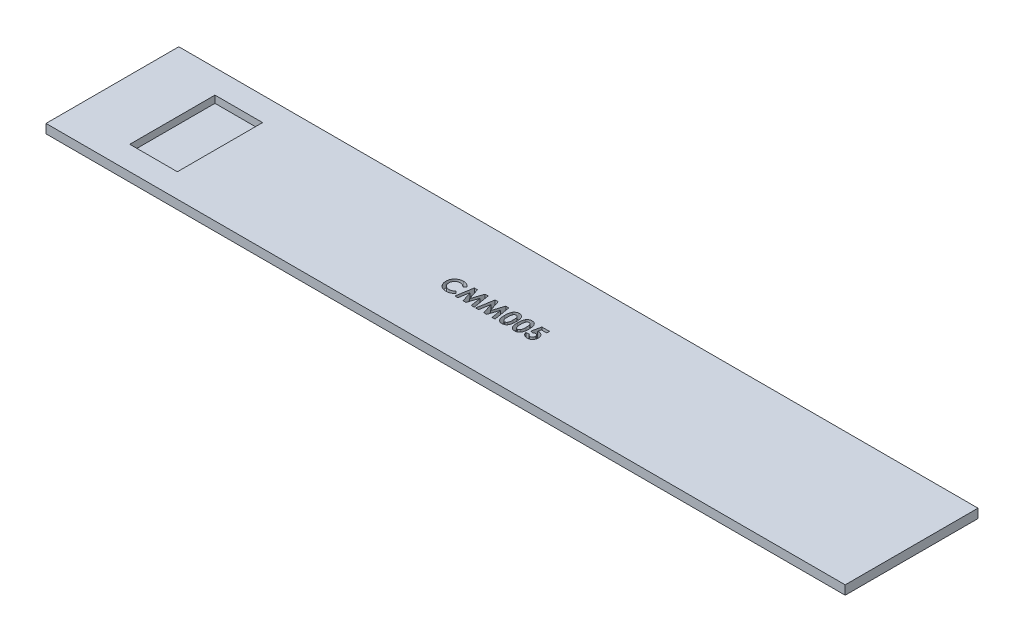
from build123d import *

# Parameters (mm, degrees)
SKETCH1_W           = 167.9
SKETCH1_H           = 27.9
BOSS_EXTRUDE1_DEPTH = 1.9
SKETCH2_W           = 10
SKETCH2_H           = 17.9
CUT_EXTRUDE1_DEPTH  = 1.5
CUT_EXTRUDE2_DEPTH  = 1.25


with BuildPart() as part:
    # Sketch1 → Boss-Extrude1 (new body)
    with BuildSketch(Plane(origin=(0, 0, 0), x_dir=(1, 0, 0), z_dir=(0, 1, 0))):
        with Locations((83.95, 13.95)):
            Rectangle(SKETCH1_W, SKETCH1_H)
    extrude(amount=BOSS_EXTRUDE1_DEPTH)

    # Sketch2 → Cut-Extrude1 (cut)
    with BuildSketch(Plane(origin=(0, 1.9, 0), x_dir=(1, 0, 0), z_dir=(0, 1, 0))):
        with Locations((17.597863854, 13.95)):
            Rectangle(SKETCH2_W, SKETCH2_H)
    extrude(amount=-CUT_EXTRUDE1_DEPTH, mode=Mode.SUBTRACT)

    # Sketch4 → Cut-Extrude2 (cut)
    # profile 1 of 6: a face of its own
    with BuildSketch(Plane(origin=(0, 1.9, 0), x_dir=(1, 0, 0), z_dir=(0, 1, 0))):
        with BuildLine():
            Line((74.029946467, 14.44485709), (73.569309447, 14.004552603))
            add(Edge.make_bspline(
                [(73.569309447, 14.004552603), (73.530234463, 14.044956202), (73.453908776, 14.123877091), (73.330919371, 14.228361392), (73.203014868, 14.315434919), (73.072683393, 14.38876769), (72.937580662, 14.444249157), (72.79926883, 14.484679437), (72.656864735, 14.50932825), (72.56049112, 14.512148511), (72.512017781, 14.513567026)],
                knots=[0, 0, 0, 0, 1.115251505, 2.178435587, 3.19620269, 4.182487026, 5.141301733, 6.088180966, 7.038406374, 8, 8, 8, 8], degree=3))
            add(Edge.make_bspline(
                [(72.512017781, 14.513567026), (72.471536651, 14.512446349), (72.391651603, 14.510234817), (72.274359418, 14.494022107), (72.162163381, 14.466451688), (72.054679428, 14.428454543), (71.952223835, 14.379288255), (71.85458179, 14.318990876), (71.761994026, 14.248106977), (71.675683574, 14.167003316), (71.596729806, 14.078391472), (71.526969124, 13.983842845), (71.468533363, 13.883574042), (71.420576085, 13.778600511), (71.383219219, 13.668436383), (71.356541723, 13.553155824), (71.341112172, 13.432621544), (71.338809208, 13.350683239), (71.337638774, 13.309039782)],
                knots=[0, 0, 0, 0, 1.035432265, 2.043311493, 3.022114605, 3.98653278, 4.95457646, 5.923598177, 6.917315552, 7.932509744, 8.948865224, 9.949768934, 10.933144597, 11.912367597, 12.897413939, 13.903909035, 14.934704909, 16, 16, 16, 16], degree=3))
            add(Edge.make_bspline(
                [(71.337638774, 13.309039782), (71.33797608, 13.27981149), (71.338640917, 13.222201927), (71.345918728, 13.136981393), (71.35763772, 13.054297328), (71.374598005, 12.974274976), (71.395807009, 12.89684499), (71.420689999, 12.821339384), (71.451905345, 12.748801476), (71.486554849, 12.678388786), (71.526851824, 12.612022611), (71.570299396, 12.548736956), (71.617411194, 12.488842039), (71.668492365, 12.432582715), (71.724261812, 12.380838189), (71.783278101, 12.332052442), (71.846536755, 12.287446746), (71.912723733, 12.245901674), (71.982410805, 12.209811116), (72.0537072, 12.177120043), (72.127693914, 12.150570031), (72.203470116, 12.1291683), (72.280765008, 12.110969323), (72.360334605, 12.099763654), (72.441489139, 12.091277732), (72.496335982, 12.090753776), (72.523936851, 12.090490103)],
                knots=[0, 0, 0, 0, 1.103660481, 2.175337485, 3.227646561, 4.255952547, 5.262355991, 6.258840057, 7.255597736, 8.242457506, 9.22035537, 10.185017736, 11.140346927, 12.096287581, 13.051739095, 14.01125915, 14.986044842, 15.97314143, 16.960198552, 17.947847494, 18.933482797, 19.925264591, 20.920966487, 21.929612487, 22.958107872, 24, 24, 24, 24], degree=3))
            add(Edge.make_bspline(
                [(72.523936851, 12.090490103), (72.570752668, 12.091844265), (72.662733574, 12.094504841), (72.79772878, 12.115310168), (72.926365762, 12.149533753), (73.029146096, 12.189949819), (73.109671772, 12.229861209), (73.170974779, 12.266777279), (73.234366866, 12.308071957), (73.298795145, 12.355303748), (73.364984306, 12.407905852), (73.431765958, 12.467030353), (73.500849723, 12.530730366), (73.546105812, 12.576194317), (73.569309447, 12.599504526)],
                knots=[0, 0, 0, 0, 1.404581149, 2.759636711, 4.088442092, 5.392261763, 6.066678138, 6.783632037, 7.538459478, 8.336747902, 9.180226004, 10.074962426, 11.012997595, 12, 12, 12, 12], degree=3))
            Line((73.569309447, 12.599504526), (74.015924031, 12.130454045))
            add(Edge.make_bspline(
                [(74.015924031, 12.130454045), (73.984529429, 12.100143543), (73.923253882, 12.040983926), (73.830821419, 11.956982789), (73.738505286, 11.88149843), (73.648535649, 11.811791096), (73.55943871, 11.749891533), (73.471223919, 11.695737919), (73.384889906, 11.647960633), (73.298643916, 11.607365413), (73.211949283, 11.572895856), (73.122750694, 11.543219829), (73.03077546, 11.518114978), (72.935461839, 11.497858661), (72.837698857, 11.481615829), (72.736571583, 11.470652011), (72.632721215, 11.463281401), (72.562277901, 11.462619091), (72.526741338, 11.462284975)],
                knots=[0, 0, 0, 0, 1.244526981, 2.429050516, 3.560637417, 4.644440555, 5.67424972, 6.652764056, 7.595344123, 8.486817594, 9.369275933, 10.254498637, 11.166417451, 12.086725134, 13.032340136, 13.991389299, 14.986715468, 16, 16, 16, 16], degree=3))
            add(Edge.make_bspline(
                [(72.526741338, 11.462284975), (72.461465074, 11.463948997), (72.333737571, 11.467205026), (72.146556244, 11.491329994), (71.968739008, 11.53177508), (71.799853267, 11.588975586), (71.639952723, 11.662046552), (71.489078283, 11.751628125), (71.347473123, 11.857482302), (71.216281133, 11.978368367), (71.097611736, 12.111876878), (70.992721731, 12.255228393), (70.905956714, 12.40912743), (70.833913852, 12.571300411), (70.777577281, 12.742487392), (70.737925886, 12.922873547), (70.71347316, 13.112284701), (70.710797997, 13.241656885), (70.709433646, 13.307637539)],
                knots=[0, 0, 0, 0, 1.078019885, 2.10938526, 3.111377082, 4.085535484, 5.04941344, 6.010039228, 6.978205633, 7.964457913, 8.951525778, 9.924444315, 10.892603023, 11.863865945, 12.85144698, 13.863884204, 14.910567087, 16, 16, 16, 16], degree=3))
            add(Edge.make_bspline(
                [(70.709433646, 13.307637539), (70.710010154, 13.350669558), (70.711152653, 13.435948503), (70.723160421, 13.561571297), (70.739899946, 13.684031051), (70.766455682, 13.802056227), (70.798466003, 13.917236841), (70.838275042, 14.028321015), (70.885819219, 14.135628016), (70.939566073, 14.239337481), (71.000369352, 14.338770004), (71.068293289, 14.433071302), (71.141589258, 14.522969363), (71.222018441, 14.607271523), (71.308412097, 14.686717971), (71.401160283, 14.760878172), (71.499705166, 14.830815667), (71.604313469, 14.894726937), (71.712952932, 14.952538078), (71.824253326, 15.003529974), (71.937941198, 15.046147456), (72.053535866, 15.081497085), (72.171525716, 15.107883084), (72.291068566, 15.127856433), (72.413181582, 15.139021664), (72.495169894, 15.140849483), (72.536557044, 15.141772154)],
                knots=[0, 0, 0, 0, 1.071919942, 2.124283339, 3.142214191, 4.149696895, 5.136002878, 6.119640489, 7.086990633, 8.058538607, 9.028339693, 9.988281803, 10.952401235, 11.916291999, 12.888973767, 13.874849856, 14.873389453, 15.898127285, 16.927174885, 17.938320013, 18.946391617, 19.950418109, 20.947802303, 21.956882652, 22.968648068, 24, 24, 24, 24], degree=3))
            add(Edge.make_bspline(
                [(72.536557044, 15.141772154), (72.571864526, 15.141243256), (72.642112391, 15.140190959), (72.74672325, 15.131418919), (72.85049748, 15.117642518), (72.953063538, 15.096856863), (73.055155081, 15.072181663), (73.155430512, 15.039872894), (73.25547173, 15.003858681), (73.353709736, 14.960811044), (73.450281658, 14.913820659), (73.542925145, 14.860508361), (73.633195673, 14.804154929), (73.719092901, 14.74142512), (73.80222587, 14.674594261), (73.88215987, 14.603350549), (73.958193432, 14.526506141), (74.005907875, 14.47221103), (74.029946467, 14.44485709)],
                knots=[0, 0, 0, 0, 0.996412454, 1.982464992, 2.961075852, 3.949442424, 4.934965278, 5.923860011, 6.921385422, 7.934793307, 8.949617135, 9.951082467, 10.950285876, 11.951772932, 12.951063433, 13.960125323, 14.972308753, 16, 16, 16, 16], degree=3))
        make_face()
    # profile 2 of 6: a face of its own
    with BuildSketch(Plane(origin=(0, 1.9, 0), x_dir=(1, 0, 0), z_dir=(0, 1, 0))):
        Polygon((74.935094704, 15.052028564), (75.587137973, 15.052028564), (76.385715697, 12.610722475), (77.189902396, 15.052028564), (77.835635569, 15.052028564), (78.427382364, 11.552028564), (77.791464896, 11.552028564), (77.417766979, 13.762665584), (76.690002556, 11.552028564), (76.077222108, 11.552028564), (75.353664415, 13.762665584), (74.98066762, 11.552028564), (74.344049031, 11.552028564), align=None)
    # profile 3 of 6: a face of its own
    with BuildSketch(Plane(origin=(0, 1.9, 0), x_dir=(1, 0, 0), z_dir=(0, 1, 0))):
        Polygon((79.287658806, 15.052028564), (79.939702076, 15.052028564), (80.7382798, 12.610722475), (81.542466499, 15.052028564), (82.188199672, 15.052028564), (82.779946467, 11.552028564), (82.144028999, 11.552028564), (81.770331082, 13.762665584), (81.042566659, 11.552028564), (80.42978621, 11.552028564), (79.706228518, 13.762665584), (79.333231723, 11.552028564), (78.696613133, 11.552028564), align=None)
    # profile 4 of 6: a face of its own
    with BuildSketch(Plane(origin=(0, 1.9, 0), x_dir=(1, 0, 0), z_dir=(0, 1, 0))):
        with BuildLine():
            add(Edge.make_bspline(
                [(84.272634768, 15.141772154), (84.303042503, 15.141320743), (84.362832236, 15.140433147), (84.450891257, 15.130819766), (84.535716442, 15.116296627), (84.617639636, 15.096041914), (84.696071148, 15.069235522), (84.771581819, 15.03714873), (84.843272854, 14.99809852), (84.912058542, 14.953989302), (84.977912387, 14.904051415), (85.039251637, 14.847119645), (85.097196478, 14.784503994), (85.150492618, 14.715257827), (85.200320316, 14.640011011), (85.246515845, 14.558751614), (85.288725569, 14.471081925), (85.327422557, 14.376843738), (85.362025526, 14.274624463), (85.391171564, 14.163251601), (85.416169168, 14.042699717), (85.43726891, 13.91266874), (85.453216905, 13.772985828), (85.463966174, 13.623743778), (85.471342832, 13.465230309), (85.471944863, 13.356491371), (85.472254159, 13.300626321)],
                knots=[0, 0, 0, 0, 0.879237366, 1.728815576, 2.559023295, 3.367336655, 4.166867292, 4.954216142, 5.737608147, 6.525189134, 7.316157332, 8.124696809, 8.942788509, 9.781158001, 10.649253743, 11.551476218, 12.482711956, 13.461909668, 14.496590415, 15.601789533, 16.789733467, 18.056700938, 19.410929216, 20.8549011, 22.384193279, 24, 24, 24, 24], degree=3))
            add(Edge.make_bspline(
                [(85.472254159, 13.300626321), (85.471919894, 13.244062336), (85.471270422, 13.134159529), (85.464272824, 12.974196215), (85.452222629, 12.823870578), (85.436691469, 12.683198172), (85.415418028, 12.552253284), (85.390503871, 12.430696853), (85.360897772, 12.318572942), (85.325154992, 12.216134189), (85.286692238, 12.121730499), (85.244367052, 12.034231746), (85.198917158, 11.953400933), (85.151385038, 11.878018619), (85.099164806, 11.810307036), (85.044798169, 11.747963635), (84.985917907, 11.693363158), (84.925003105, 11.643691739), (84.859822209, 11.600765666), (84.791047411, 11.56322323), (84.717452577, 11.532771855), (84.640379215, 11.506286876), (84.558513594, 11.487273519), (84.473156548, 11.472187045), (84.383344412, 11.463849334), (84.322196693, 11.462814986), (84.290863935, 11.462284975)],
                knots=[0, 0, 0, 0, 1.643780988, 3.193836972, 4.651895693, 6.025988579, 7.305620092, 8.505800249, 9.631074763, 10.672816429, 11.65661981, 12.592235626, 13.49536222, 14.350718032, 15.179365177, 15.97804903, 16.751647189, 17.51006938, 18.259804725, 19.016521909, 19.783502495, 20.571750527, 21.382245291, 22.22305063, 23.089471752, 24, 24, 24, 24], degree=3))
            add(Edge.make_bspline(
                [(84.290863935, 11.462284975), (84.259532022, 11.462825209), (84.198153265, 11.463883521), (84.108098268, 11.47212505), (84.022288873, 11.487334634), (83.939775563, 11.506432847), (83.86113262, 11.532713255), (83.785982951, 11.564075713), (83.714904395, 11.601383903), (83.647700144, 11.64440999), (83.584599653, 11.693749069), (83.524622341, 11.748873402), (83.467900882, 11.809643265), (83.41529815, 11.876739329), (83.365952663, 11.949266003), (83.320379018, 12.028051505), (83.278604602, 12.112981126), (83.239322705, 12.204173248), (83.205191709, 12.303591135), (83.174816707, 12.412122573), (83.149934305, 12.530672264), (83.129922212, 12.659202122), (83.113944568, 12.797439849), (83.102059038, 12.945452171), (83.095022571, 13.103308026), (83.09437991, 13.211810219), (83.094049031, 13.267673596)],
                knots=[0, 0, 0, 0, 0.917216111, 1.796812873, 2.643793957, 3.46689424, 4.273913431, 5.068098542, 5.848489301, 6.620921603, 7.401012384, 8.190319798, 9.003608147, 9.831726257, 10.68377682, 11.569763213, 12.493818149, 13.453288342, 14.474581811, 15.568529029, 16.750744269, 18.018426408, 19.375425659, 20.823733699, 22.36466933, 24, 24, 24, 24], degree=3))
            add(Edge.make_bspline(
                [(83.094049031, 13.267673596), (83.094648389, 13.345291362), (83.095804857, 13.49505584), (83.110460478, 13.711421966), (83.131971211, 13.91141497), (83.163565383, 14.094700313), (83.20263114, 14.261956829), (83.252656876, 14.412082721), (83.309607537, 14.547155316), (83.358136817, 14.627173135), (83.381508967, 14.665710455)],
                knots=[0, 0, 0, 0, 1.288568992, 2.486310467, 3.599230591, 4.627010532, 5.572937695, 6.447898582, 7.252493626, 8, 8, 8, 8], degree=3))
            add(Edge.make_bspline(
                [(83.381508967, 14.665710455), (83.408684989, 14.703569507), (83.461819466, 14.777591412), (83.554726586, 14.874768338), (83.65454319, 14.957878804), (83.763319454, 15.025041944), (83.879335037, 15.078006803), (84.00358599, 15.115415286), (84.135613477, 15.137211211), (84.226278954, 15.140229137), (84.272634768, 15.141772154)],
                knots=[0, 0, 0, 0, 1.058512271, 2.069600068, 3.047294572, 4.004278952, 4.967380941, 5.939006123, 6.946246673, 8, 8, 8, 8], degree=3))
        make_face()
        with BuildLine():
            add(Edge.make_bspline(
                [(84.288059447, 14.513567026), (84.260570602, 14.512264109), (84.206677874, 14.509709701), (84.128476957, 14.48802638), (84.054738375, 14.45453532), (83.998647406, 14.414234067), (83.956663873, 14.375600483), (83.927329677, 14.340638345), (83.899041469, 14.301623119), (83.874055899, 14.256794249), (83.850462999, 14.207762488), (83.827405624, 14.154305262), (83.808504631, 14.095109546), (83.789934906, 14.031183449), (83.773666095, 13.960759587), (83.760036398, 13.88326232), (83.747859461, 13.798187678), (83.739365903, 13.705479936), (83.731447357, 13.60523609), (83.725770969, 13.497232835), (83.723397814, 13.381499308), (83.72264346, 13.301795345), (83.722254159, 13.260662378)],
                knots=[0, 0, 0, 0, 1.076674018, 2.110852608, 3.161083442, 4.239746716, 4.804137807, 5.395870207, 6.026861976, 6.692161227, 7.405688833, 8.16177676, 8.973626916, 9.841385931, 10.773283133, 11.807421078, 12.927755683, 14.143907515, 15.458935494, 16.872852025, 18.386167141, 20, 20, 20, 20], degree=3))
            add(Edge.make_bspline(
                [(83.722254159, 13.260662378), (83.722894901, 13.207372631), (83.724123571, 13.105185591), (83.73055877, 12.958237068), (83.743457592, 12.824502079), (83.759501123, 12.703074254), (83.782034918, 12.594741083), (83.807961507, 12.498477635), (83.839978539, 12.415511034), (83.876980389, 12.344641398), (83.917961605, 12.284352746), (83.962448518, 12.23310712), (84.008926508, 12.188730825), (84.058846303, 12.152684508), (84.112088811, 12.125060272), (84.168209554, 12.105190501), (84.227244196, 12.093027386), (84.26767051, 12.091340753), (84.288059447, 12.090490103)],
                knots=[0, 0, 0, 0, 1.771748488, 3.397459088, 4.888034009, 6.237357457, 7.467047327, 8.564189669, 9.548206622, 10.417051504, 11.216568818, 11.965764335, 12.669334354, 13.348544111, 14.005342236, 14.656555988, 15.322436492, 16, 16, 16, 16], degree=3))
            add(Edge.make_bspline(
                [(84.288059447, 12.090490103), (84.307748701, 12.091072181), (84.346297811, 12.092211817), (84.402511046, 12.103910033), (84.455670276, 12.122928791), (84.505614996, 12.14983216), (84.552523851, 12.184043909), (84.59616758, 12.22571438), (84.63621703, 12.27525893), (84.659550022, 12.312028314), (84.671573069, 12.330974878)],
                knots=[0, 0, 0, 0, 0.992283464, 1.942767638, 2.88273346, 3.832339453, 4.79467288, 5.803907806, 6.868395428, 8, 8, 8, 8], degree=3))
            add(Edge.make_bspline(
                [(84.671573069, 12.330974878), (84.685728182, 12.356864753), (84.715410307, 12.411153722), (84.749758512, 12.502764332), (84.778670917, 12.606085959), (84.803555401, 12.721440149), (84.82057487, 12.849281874), (84.835232016, 12.988800479), (84.842301522, 13.140698522), (84.843451416, 13.245934035), (84.844049031, 13.300626321)],
                knots=[0, 0, 0, 0, 0.710965849, 1.490837728, 2.352621235, 3.297892224, 4.334225155, 5.461620853, 6.680770821, 8, 8, 8, 8], degree=3))
            add(Edge.make_bspline(
                [(84.844049031, 13.300626321), (84.843818185, 13.355793362), (84.843373846, 13.4619805), (84.835221519, 13.614424627), (84.823868781, 13.753657037), (84.807263003, 13.87936688), (84.78589665, 13.991859325), (84.75956254, 14.091127018), (84.728516583, 14.177365597), (84.691699779, 14.250489069), (84.65092288, 14.31263399), (84.607636957, 14.365949511), (84.561658979, 14.411468958), (84.513065837, 14.449363629), (84.460732826, 14.478317999), (84.405659573, 14.49876218), (84.347733175, 14.511130224), (84.308219171, 14.512743795), (84.288059447, 14.513567026)],
                knots=[0, 0, 0, 0, 1.793836731, 3.452829483, 4.963243077, 6.335886805, 7.574563692, 8.684454726, 9.672768357, 10.54971625, 11.340229787, 12.085688095, 12.778991901, 13.440269426, 14.083255152, 14.715733572, 15.344777694, 16, 16, 16, 16], degree=3))
        make_face(mode=Mode.SUBTRACT)
    # profile 5 of 6: a face of its own
    with BuildSketch(Plane(origin=(0, 1.9, 0), x_dir=(1, 0, 0), z_dir=(0, 1, 0))):
        with BuildLine():
            add(Edge.make_bspline(
                [(86.96494246, 15.141772154), (86.995350196, 15.141320743), (87.055139928, 15.140433147), (87.14319895, 15.130819766), (87.228024134, 15.116296627), (87.309947328, 15.096041914), (87.38837884, 15.069235522), (87.463889512, 15.03714873), (87.535580546, 14.99809852), (87.604366234, 14.953989302), (87.670220079, 14.904051415), (87.731559329, 14.847119645), (87.789504171, 14.784503994), (87.842800311, 14.715257827), (87.892628008, 14.640011011), (87.938823538, 14.558751614), (87.981033261, 14.471081925), (88.019730249, 14.376843738), (88.054333218, 14.274624463), (88.083479256, 14.163251601), (88.10847686, 14.042699717), (88.129576602, 13.91266874), (88.145524597, 13.772985828), (88.156273866, 13.623743778), (88.163650524, 13.465230309), (88.164252555, 13.356491371), (88.164561851, 13.300626321)],
                knots=[0, 0, 0, 0, 0.879237366, 1.728815576, 2.559023295, 3.367336655, 4.166867292, 4.954216142, 5.737608147, 6.525189134, 7.316157332, 8.124696809, 8.942788509, 9.781158001, 10.649253743, 11.551476218, 12.482711956, 13.461909668, 14.496590415, 15.601789533, 16.789733467, 18.056700938, 19.410929216, 20.8549011, 22.384193279, 24, 24, 24, 24], degree=3))
            add(Edge.make_bspline(
                [(88.164561851, 13.300626321), (88.164227586, 13.244062336), (88.163578114, 13.134159529), (88.156580516, 12.974196215), (88.144530322, 12.823870578), (88.128999161, 12.683198172), (88.10772572, 12.552253284), (88.082811563, 12.430696853), (88.053205464, 12.318572942), (88.017462684, 12.216134189), (87.97899993, 12.121730499), (87.936674745, 12.034231746), (87.89122485, 11.953400933), (87.84369273, 11.878018619), (87.791472499, 11.810307036), (87.737105862, 11.747963635), (87.678225599, 11.693363158), (87.617310798, 11.643691739), (87.552129901, 11.600765666), (87.483355104, 11.56322323), (87.409760269, 11.532771855), (87.332686907, 11.506286876), (87.250821287, 11.487273519), (87.16546424, 11.472187045), (87.075652105, 11.463849334), (87.014504385, 11.462814986), (86.983171627, 11.462284975)],
                knots=[0, 0, 0, 0, 1.643780988, 3.193836972, 4.651895693, 6.025988579, 7.305620092, 8.505800249, 9.631074763, 10.672816429, 11.65661981, 12.592235626, 13.49536222, 14.350718032, 15.179365177, 15.97804903, 16.751647189, 17.51006938, 18.259804725, 19.016521909, 19.783502495, 20.571750527, 21.382245291, 22.22305063, 23.089471752, 24, 24, 24, 24], degree=3))
            add(Edge.make_bspline(
                [(86.983171627, 11.462284975), (86.951839714, 11.462825209), (86.890460957, 11.463883521), (86.800405961, 11.47212505), (86.714596565, 11.487334634), (86.632083256, 11.506432847), (86.553440312, 11.532713255), (86.478290644, 11.564075713), (86.407212087, 11.601383903), (86.340007836, 11.64440999), (86.276907345, 11.693749069), (86.216930034, 11.748873402), (86.160208575, 11.809643265), (86.107605842, 11.876739329), (86.058260355, 11.949266003), (86.01268671, 12.028051505), (85.970912295, 12.112981126), (85.931630398, 12.204173248), (85.897499401, 12.303591135), (85.8671244, 12.412122573), (85.842241997, 12.530672264), (85.822229904, 12.659202122), (85.80625226, 12.797439849), (85.79436673, 12.945452171), (85.787330263, 13.103308026), (85.786687603, 13.211810219), (85.786356723, 13.267673596)],
                knots=[0, 0, 0, 0, 0.917216111, 1.796812873, 2.643793957, 3.46689424, 4.273913431, 5.068098542, 5.848489301, 6.620921603, 7.401012384, 8.190319798, 9.003608147, 9.831726257, 10.68377682, 11.569763213, 12.493818149, 13.453288342, 14.474581811, 15.568529029, 16.750744269, 18.018426408, 19.375425659, 20.823733699, 22.36466933, 24, 24, 24, 24], degree=3))
            add(Edge.make_bspline(
                [(85.786356723, 13.267673596), (85.786956081, 13.345291362), (85.788112549, 13.49505584), (85.80276817, 13.711421966), (85.824278903, 13.91141497), (85.855873076, 14.094700313), (85.894938833, 14.261956829), (85.944964568, 14.412082721), (86.00191523, 14.547155316), (86.05044451, 14.627173135), (86.073816659, 14.665710455)],
                knots=[0, 0, 0, 0, 1.288568992, 2.486310467, 3.599230591, 4.627010532, 5.572937695, 6.447898582, 7.252493626, 8, 8, 8, 8], degree=3))
            add(Edge.make_bspline(
                [(86.073816659, 14.665710455), (86.100992681, 14.703569507), (86.154127159, 14.777591412), (86.247034278, 14.874768338), (86.346850882, 14.957878804), (86.455627147, 15.025041944), (86.571642729, 15.078006803), (86.695893682, 15.115415286), (86.827921169, 15.137211211), (86.918586646, 15.140229137), (86.96494246, 15.141772154)],
                knots=[0, 0, 0, 0, 1.058512271, 2.069600068, 3.047294572, 4.004278952, 4.967380941, 5.939006123, 6.946246673, 8, 8, 8, 8], degree=3))
        make_face()
        with BuildLine():
            add(Edge.make_bspline(
                [(86.98036714, 14.513567026), (86.952878295, 14.512264109), (86.898985566, 14.509709701), (86.82078465, 14.48802638), (86.747046068, 14.45453532), (86.690955098, 14.414234067), (86.648971565, 14.375600483), (86.61963737, 14.340638345), (86.591349161, 14.301623119), (86.566363591, 14.256794249), (86.542770691, 14.207762488), (86.519713316, 14.154305262), (86.500812323, 14.095109546), (86.482242599, 14.031183449), (86.465973787, 13.960759587), (86.45234409, 13.88326232), (86.440167153, 13.798187678), (86.431673595, 13.705479936), (86.42375505, 13.60523609), (86.418078661, 13.497232835), (86.415705506, 13.381499308), (86.414951152, 13.301795345), (86.414561851, 13.260662378)],
                knots=[0, 0, 0, 0, 1.076674018, 2.110852608, 3.161083442, 4.239746716, 4.804137807, 5.395870207, 6.026861976, 6.692161227, 7.405688833, 8.16177676, 8.973626916, 9.841385931, 10.773283133, 11.807421078, 12.927755683, 14.143907515, 15.458935494, 16.872852025, 18.386167141, 20, 20, 20, 20], degree=3))
            add(Edge.make_bspline(
                [(86.414561851, 13.260662378), (86.415202593, 13.207372631), (86.416431263, 13.105185591), (86.422866462, 12.958237068), (86.435765285, 12.824502079), (86.451808816, 12.703074254), (86.47434261, 12.594741083), (86.500269199, 12.498477635), (86.532286232, 12.415511034), (86.569288082, 12.344641398), (86.610269298, 12.284352746), (86.65475621, 12.23310712), (86.7012342, 12.188730825), (86.751153995, 12.152684508), (86.804396503, 12.125060272), (86.860517246, 12.105190501), (86.919551888, 12.093027386), (86.959978203, 12.091340753), (86.98036714, 12.090490103)],
                knots=[0, 0, 0, 0, 1.771748488, 3.397459088, 4.888034009, 6.237357457, 7.467047327, 8.564189669, 9.548206622, 10.417051504, 11.216568818, 11.965764335, 12.669334354, 13.348544111, 14.005342236, 14.656555988, 15.322436492, 16, 16, 16, 16], degree=3))
            add(Edge.make_bspline(
                [(86.98036714, 12.090490103), (87.000056393, 12.091072181), (87.038605503, 12.092211817), (87.094818738, 12.103910033), (87.147977968, 12.122928791), (87.197922688, 12.14983216), (87.244831543, 12.184043909), (87.288475272, 12.22571438), (87.328524723, 12.27525893), (87.351857714, 12.312028314), (87.363880761, 12.330974878)],
                knots=[0, 0, 0, 0, 0.992283464, 1.942767638, 2.88273346, 3.832339453, 4.79467288, 5.803907806, 6.868395428, 8, 8, 8, 8], degree=3))
            add(Edge.make_bspline(
                [(87.363880761, 12.330974878), (87.378035875, 12.356864753), (87.407717999, 12.411153722), (87.442066204, 12.502764332), (87.470978609, 12.606085959), (87.495863093, 12.721440149), (87.512882563, 12.849281874), (87.527539709, 12.988800479), (87.534609214, 13.140698522), (87.535759108, 13.245934035), (87.536356723, 13.300626321)],
                knots=[0, 0, 0, 0, 0.710965849, 1.490837728, 2.352621235, 3.297892224, 4.334225155, 5.461620853, 6.680770821, 8, 8, 8, 8], degree=3))
            add(Edge.make_bspline(
                [(87.536356723, 13.300626321), (87.536125877, 13.355793362), (87.535681539, 13.4619805), (87.527529212, 13.614424627), (87.516176474, 13.753657037), (87.499570695, 13.87936688), (87.478204343, 13.991859325), (87.451870233, 14.091127018), (87.420824276, 14.177365597), (87.384007471, 14.250489069), (87.343230572, 14.31263399), (87.299944649, 14.365949511), (87.253966672, 14.411468958), (87.20537353, 14.449363629), (87.153040518, 14.478317999), (87.097967266, 14.49876218), (87.040040868, 14.511130224), (87.000526864, 14.512743795), (86.98036714, 14.513567026)],
                knots=[0, 0, 0, 0, 1.793836731, 3.452829483, 4.963243077, 6.335886805, 7.574563692, 8.684454726, 9.672768357, 10.54971625, 11.340229787, 12.085688095, 12.778991901, 13.440269426, 14.083255152, 14.715733572, 15.344777694, 16, 16, 16, 16], degree=3))
        make_face(mode=Mode.SUBTRACT)
    # profile 6 of 6: a face of its own
    with BuildSketch(Plane(origin=(0, 1.9, 0), x_dir=(1, 0, 0), z_dir=(0, 1, 0))):
        with BuildLine():
            Line((89.128604319, 15.052028564), (90.722254159, 15.052028564))
            Line((90.722254159, 15.052028564), (90.722254159, 14.468695231))
            Line((90.722254159, 14.468695231), (89.626400794, 14.468695231))
            Line((89.626400794, 14.468695231), (89.489682044, 13.806836257))
            add(Edge.make_bspline(
                [(89.489682044, 13.806836257), (89.50831193, 13.812024915), (89.545053895, 13.822258016), (89.60040571, 13.832520522), (89.654049332, 13.839172352), (89.68924995, 13.840059617), (89.706328678, 13.840490103)],
                knots=[0, 0, 0, 0, 1.05461699, 2.079921384, 3.068411212, 4, 4, 4, 4], degree=3))
            add(Edge.make_bspline(
                [(89.706328678, 13.840490103), (89.743545016, 13.839637312), (89.816906616, 13.837956273), (89.924225328, 13.821997734), (90.026989335, 13.796863519), (90.124884167, 13.761016942), (90.217814194, 13.714361696), (90.305892065, 13.657921927), (90.389225882, 13.591598506), (90.466335286, 13.515349909), (90.537186626, 13.431627223), (90.598787826, 13.34107228), (90.651399095, 13.244976304), (90.693244279, 13.142741965), (90.726272066, 13.035011364), (90.750138682, 12.921715464), (90.764252205, 12.802719991), (90.766155327, 12.721537888), (90.767125954, 12.680133532)],
                knots=[0, 0, 0, 0, 1.01440847, 1.999622559, 2.951875003, 3.895578053, 4.836219714, 5.782137149, 6.743708247, 7.735272588, 8.734977101, 9.730283169, 10.717124674, 11.717316708, 12.737475749, 13.78628267, 14.87096371, 16, 16, 16, 16], degree=3))
            add(Edge.make_bspline(
                [(90.767125954, 12.680133532), (90.765939832, 12.638259141), (90.763599267, 12.555628726), (90.748329225, 12.434132789), (90.721377327, 12.317767108), (90.684356198, 12.206220177), (90.635583231, 12.100311839), (90.576927063, 11.998944961), (90.507395976, 11.902871959), (90.427672308, 11.813077697), (90.341002224, 11.731004018), (90.248719044, 11.658803645), (90.151471084, 11.598047616), (90.049255998, 11.548946473), (89.942660228, 11.510098523), (89.831651419, 11.481819069), (89.715690083, 11.465602374), (89.636967403, 11.463402926), (89.596953678, 11.462284975)],
                knots=[0, 0, 0, 0, 1.06808661, 2.107647099, 3.116961351, 4.110378221, 5.100014249, 6.085620622, 7.093190682, 8.119403071, 9.144090782, 10.133780668, 11.103064255, 12.062861538, 13.020824475, 13.992378307, 14.979551724, 16, 16, 16, 16], degree=3))
            add(Edge.make_bspline(
                [(89.596953678, 11.462284975), (89.561170595, 11.463199528), (89.490598865, 11.46500322), (89.386649807, 11.476089657), (89.286431371, 11.495690582), (89.190475608, 11.524058197), (89.097772903, 11.558972254), (89.009394927, 11.60263888), (88.924856026, 11.654226605), (88.844396259, 11.71279395), (88.769322983, 11.778767793), (88.700804052, 11.850987531), (88.638424643, 11.92854287), (88.583519578, 12.012390606), (88.536260968, 12.10240686), (88.494351068, 12.197530769), (88.460047395, 12.29875573), (88.44263927, 12.368930497), (88.43379262, 12.404592667)],
                knots=[0, 0, 0, 0, 1.054957082, 2.080596141, 3.077793124, 4.061112343, 5.027190972, 5.994718051, 6.962465889, 7.943658696, 8.924948258, 9.904494768, 10.875059, 11.855380583, 12.854004648, 13.869083016, 14.917087635, 16, 16, 16, 16], degree=3))
            Line((88.43379262, 12.404592667), (89.151741338, 12.404592667))
            add(Edge.make_bspline(
                [(89.151741338, 12.404592667), (89.164865458, 12.379880236), (89.190370688, 12.331854445), (89.238887272, 12.268092993), (89.293198509, 12.213719965), (89.35281448, 12.168204126), (89.418121461, 12.134104435), (89.486458314, 12.108244806), (89.558683528, 12.093301484), (89.607872088, 12.091433421), (89.63271089, 12.090490103)],
                knots=[0, 0, 0, 0, 1.104910296, 2.147267069, 3.153527244, 4.136738762, 5.099945312, 6.05603338, 7.018353, 8, 8, 8, 8], degree=3))
            add(Edge.make_bspline(
                [(89.63271089, 12.090490103), (89.650023201, 12.091141472), (89.684085466, 12.092423052), (89.734270828, 12.099202933), (89.78217496, 12.112043873), (89.828154019, 12.12982559), (89.872331516, 12.152001399), (89.914074151, 12.179996914), (89.954108171, 12.212220789), (89.991824096, 12.249197795), (90.025983854, 12.290418556), (90.055938224, 12.334713073), (90.082721562, 12.381097114), (90.10256039, 12.431408065), (90.118806712, 12.484143625), (90.130771161, 12.539701594), (90.137921269, 12.598146859), (90.138583178, 12.638045803), (90.138920826, 12.658398757)],
                knots=[0, 0, 0, 0, 0.978869489, 1.925942215, 2.855067702, 3.774946051, 4.70828698, 5.642468714, 6.60995405, 7.609372294, 8.622401667, 9.629904756, 10.629323, 11.642352373, 12.678539694, 13.745912462, 14.850161547, 16, 16, 16, 16], degree=3))
            add(Edge.make_bspline(
                [(90.138920826, 12.658398757), (90.138528946, 12.678279272), (90.137766143, 12.716977179), (90.131456084, 12.773799567), (90.120167511, 12.82771373), (90.104786732, 12.87913261), (90.0850975, 12.927743967), (90.061035941, 12.973837158), (90.032499263, 13.0171792), (89.999334259, 13.056887691), (89.96396744, 13.093309449), (89.925972112, 13.125163627), (89.885690592, 13.151600384), (89.84437458, 13.174680442), (89.800374888, 13.191477605), (89.754680894, 13.203045191), (89.70734065, 13.211533021), (89.675050897, 13.212031712), (89.658652396, 13.212284975)],
                knots=[0, 0, 0, 0, 1.166249705, 2.270133367, 3.348514167, 4.393962215, 5.415026464, 6.420877785, 7.440098956, 8.453121383, 9.451844239, 10.415694839, 11.355045125, 12.27538808, 13.187007209, 14.108269027, 15.039275622, 16, 16, 16, 16], degree=3))
            add(Edge.make_bspline(
                [(89.658652396, 13.212284975), (89.640839812, 13.211609086), (89.605139573, 13.21025446), (89.552097953, 13.199232232), (89.499695868, 13.181394133), (89.447641907, 13.156783648), (89.396452797, 13.124576288), (89.344777633, 13.086800748), (89.294346091, 13.040712276), (89.262280315, 13.006385477), (89.245691659, 12.988627122)],
                knots=[0, 0, 0, 0, 0.88288272, 1.769486374, 2.674910571, 3.623812639, 4.617874466, 5.670434592, 6.794841017, 8, 8, 8, 8], degree=3))
            Line((89.245691659, 12.988627122), (88.717045826, 13.109921193))
            Line((88.717045826, 13.109921193), (89.128604319, 15.052028564))
        make_face()
    extrude(amount=-CUT_EXTRUDE2_DEPTH, mode=Mode.SUBTRACT)


solid = part.part
